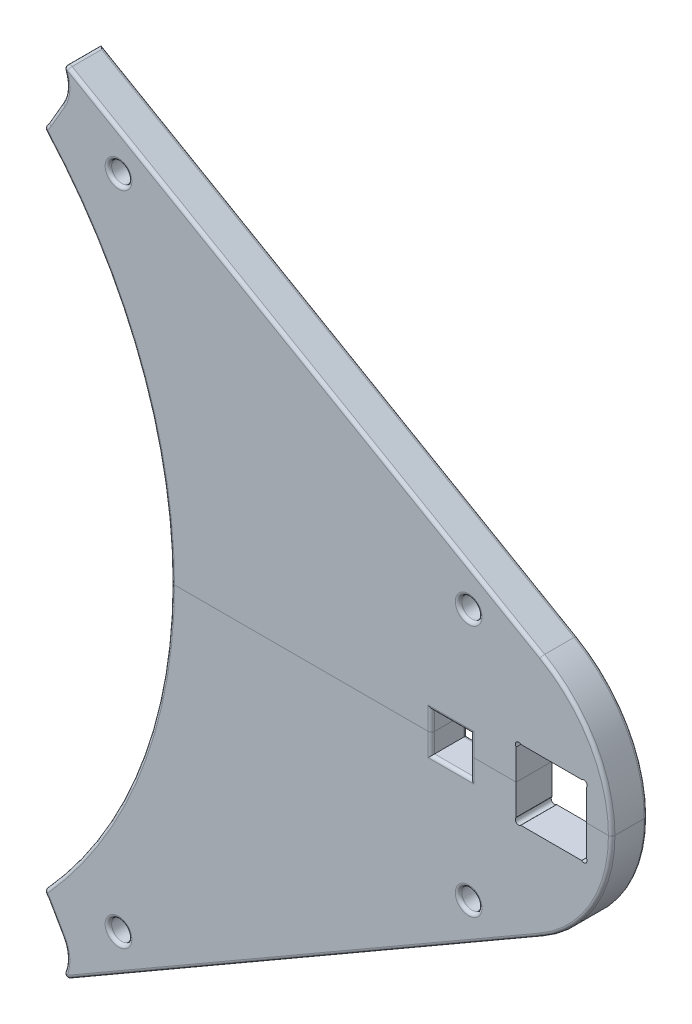
from build123d import *

# Parameters (mm, degrees)
BOSS_EXTRUDE1_DEPTH = 11
CUT_EXTRUDE1_DEPTH  = 9
SKETCH4_W           = 42.9
SKETCH4_H           = 3
BOSS_EXTRUDE2_DEPTH = 6
BOSS_EXTRUDE3_START = 2
BOSS_EXTRUDE3_DEPTH = 2
BOSS_EXTRUDE5_DEPTH = 4
SKETCH9_R           = 1.6
CUT_EXTRUDE3_DEPTH  = 195.492671892
SKETCH12_R          = 1.6
CUT_EXTRUDE6_DEPTH  = 199.866548237
SKETCH13_R          = 3.1
CUT_EXTRUDE7_DEPTH  = 9
FILLET1_R           = 1
FILLET2_R           = 1
SKETCH10_R          = 2.9
CUT_EXTRUDE4_DEPTH  = 2
CUT_EXTRUDE5_DEPTH  = 2


with BuildPart() as part:
    # Sketch2 → Boss-Extrude1 (new body)
    with BuildSketch(Plane.XY):
        with BuildLine():
            Line((-3, 37.320508076), (-151.33994183, 122.964613423))
            ThreePointArc((-151.33994183, 122.964613423), (-148.672488109, 117.025214433), (-150.019309217, 110.655140444))
            Line((-150.019309217, 110.655140444), (-154.249735612, 103.327826991))
            ThreePointArc((-154.249735612, 103.327826991), (-154.570890543, 102.807207058), (-154.921817791, 102.306172457))
            ThreePointArc((-154.921817791, 102.306172457), (-155.321726923, 101.80219857), (-155.751750724, 101.323662758))
            ThreePointArc((-155.751750724, 101.323662758), (-126.680553576, 54.324274768), (-116.534118443, 0))
            Line((-116.534118443, 0), (-36.75, 0))
            Line((-36.75, 0), (-36.75, 6))
            Line((-36.75, 6), (-24.75, 6))
            Line((-24.75, 6), (-24.75, 0))
            Line((-24.75, 0), (-10.75, 0))
            Line((-10.75, 0), (-10.75, 9.338562172))
            ThreePointArc((-10.75, 9.338562172), (-10.707106781, 10.707106781), (-9.338562172, 10.75))
            Line((-9.338562172, 10.75), (9.338562172, 10.75))
            ThreePointArc((9.338562172, 10.75), (10.707106781, 10.707106781), (10.75, 9.338562172))
            Line((10.75, 9.338562172), (10.75, 0))
            Line((10.75, 0), (18.547005384, 0))
            ThreePointArc((18.547005384, 0), (12.773502692, 21.547005384), (-3, 37.320508076))
        make_face()
    extrude(amount=BOSS_EXTRUDE1_DEPTH)

    # Sketch3 → Cut-Extrude1 (cut)
    with BuildSketch(Plane(origin=(0, 0, 0), x_dir=(-1, 0, 0), z_dir=(0, 0, -1))):
        with BuildLine():
            Line((45, 3), (39.75, 3))
            Line((39.75, 3), (39.75, 9))
            Line((39.75, 9), (21.75, 9))
            Line((21.75, 9), (21.75, 3))
            Line((21.75, 3), (16.530219865, 3))
            ThreePointArc((16.530219865, 3), (15.482056552, 7.129264091), (13.610574403, 10.956406998))
            ThreePointArc((13.610574403, 10.956406998), (13.129517789, 12.079935594), (13.010176178, 13.296278288))
            ThreePointArc((13.010176178, 13.296278288), (13.596801197, 15.169575131), (15.004001401, 16.538208595))
            Line((15.004001401, 16.538208595), (17.45348662, 17.952419546))
            Line((17.45348662, 17.952419546), (37.5, 29.526279442))
            ThreePointArc((37.5, 29.526279442), (42.5, 29.526279442), (45, 25.196152423))
            Line((45, 25.196152423), (45, 3))
        make_face()
        with BuildLine():
            Line((49, 0), (91.9, 0))
            Line((91.9, 0), (91.9, 3))
            Line((91.9, 3), (113.563437204, 3))
            ThreePointArc((113.563437204, 3), (123.360068461, 54.03718499), (149.625004336, 98.880483032))
            Line((149.625004336, 98.880483032), (64.095498823, 49.5))
            Line((64.095498823, 49.5), (66.095498823, 46.035898385))
            Line((66.095498823, 46.035898385), (56.5, 40.495934556))
            ThreePointArc((56.5, 40.495934556), (51.009618943, 35.005553499), (49, 27.505553499))
            Line((49, 27.505553499), (49, 0))
        make_face()
    extrude(amount=-CUT_EXTRUDE1_DEPTH, mode=Mode.SUBTRACT)

    # Sketch4 → Boss-Extrude2 (add)
    with BuildSketch(Plane(origin=(0, 0, 9), x_dir=(-1, 0, 0), z_dir=(0, 0, -1))):
        with Locations((70.45, 1.5)):
            Rectangle(SKETCH4_W, SKETCH4_H)
    extrude(amount=BOSS_EXTRUDE2_DEPTH)

    # Sketch5 → Boss-Extrude3 (add)
    with BuildSketch(Plane(origin=(0, 0, 0), x_dir=(-1, 0, 0), z_dir=(0, 0, -1)).offset(BOSS_EXTRUDE3_START)):
        with BuildLine():
            Line((6.5, 31.258330249), (9.5, 26.062177826))
            Line((9.5, 26.062177826), (151.519309217, 108.057064233))
            Line((151.519309217, 108.057064233), (150.019309217, 110.655140444))
            ThreePointArc((150.019309217, 110.655140444), (149.356631456, 112.02293142), (148.898363428, 113.472063706))
            Line((148.898363428, 113.472063706), (6.5, 31.258330249))
        make_face()
    extrude(amount=-BOSS_EXTRUDE3_DEPTH)

    # Sketch8 → Boss-Extrude5 (add)
    with BuildSketch(Plane(origin=(0, 3, 0), x_dir=(1, 0, 0), z_dir=(0, 1, 0))):
        Polygon((-113.563437204, 0), (-115.804358566, 0), (-115.804358566, -9), (-91.9, -9), (-91.9, 0), align=None)
    extrude(amount=BOSS_EXTRUDE5_DEPTH)

    # Sketch9 → Cut-Extrude3 (cut, through all)
    with BuildSketch(Plane(origin=(0, 7, 0), x_dir=(1, 0, 0), z_dir=(0, 1, 0))):
        with Locations(Location((-96.9, -4.5, 0), (0, 0, 180))):
            Circle(SKETCH9_R)
        with Locations((-108.693810631, -4.5)):
            Circle(SKETCH9_R)
    extrude(amount=-CUT_EXTRUDE3_DEPTH, mode=Mode.SUBTRACT)

    # Sketch12 → Cut-Extrude6 (cut, through all)
    with BuildSketch(Plane(origin=(0, 0, -2), x_dir=(-1, 0, 0), z_dir=(0, 0, -1))):
        with Locations((25.320508076, 38.660254038)):
            Circle(SKETCH12_R)
        with Locations(Location((132.698801141, 100.655140444, 0), (0, 0, 180))):
            Circle(SKETCH12_R)
    extrude(amount=-CUT_EXTRUDE6_DEPTH, mode=Mode.SUBTRACT)

    # Sketch13 → Cut-Extrude7 (cut)
    with BuildSketch(Plane.XY.offset(11)):
        with Locations((-132.698801141, 100.655140444)):
            Circle(SKETCH13_R)
        with Locations((-25.320508076, 38.660254038)):
            Circle(SKETCH13_R)
    extrude(amount=-CUT_EXTRUDE7_DEPTH, mode=Mode.SUBTRACT)

    # Fillet1
    fillet1_edges = [part.edges().sort_by_distance(p)[0] for p in [
        (-36.75, 3, 0),
        (-30.75, 6, 0),
        (-24.75, 3, 0),
        (-155.751750724, 101.323662758, 5.5),
        (12.773502692, 21.547005384, 0),
        (-77.169970915, 80.142560749, 0),
        (-126.680553576, 54.324274768, 0),
        (-151.33994183, 122.964613423, 5.5),
        (-154.940773072, 102.280800459, 11),
        (-126.680553576, 54.324274768, 11),
        (-36.75, 3, 11),
        (-30.75, 6, 11),
        (-24.75, 3, 11),
        (12.773502692, 21.547005384, 11),
        (-77.169970915, 80.142560749, 11),
        (-148.672488109, 117.025214433, 11),
        (-152.134522414, 106.991483718, 11),
    ]]
    fillet(fillet1_edges, radius=FILLET1_R)

    # Fillet2
    fillet2_edges = [part.edges().sort_by_distance(p)[0] for p in [
        (-124.076718642, 55.905561816, 0),
        (-124.076718642, 55.905561816, 9),
        (-113.693810631, 7, 4.5),
        (-102.796905316, 7, 9),
        (-91.9, 7, 4.5),
        (-102.796905316, 7, 0),
        (-91.9, 3, 6),
        (-91.9, 5, 9),
        (-135.798801141, 100.655140444, 11),
        (-28.420508076, 38.660254038, 11),
        (-42.5, 29.526279442, 0),
        (-26.2520007, 23.032244018, 0),
        (-13.123100608, 14.042925352, 0),
        (-15.482056552, 7.129264091, 0),
        (-19.140109932, 3, 0),
        (-21.75, 6, 0),
        (-30.75, 9, 0),
        (-39.75, 6, 0),
        (-42.375, 3, 0),
        (-45, 14.098076211, 0),
        (-26.2520007, 23.032244018, 9),
        (-13.123100608, 14.042925352, 9),
        (-15.482056552, 7.129264091, 9),
        (-16.530219865, 3, 4.5),
        (-19.140109932, 3, 9),
        (-21.75, 3, 4.5),
        (-21.75, 6, 9),
        (-21.75, 9, 4.5),
        (-30.75, 9, 9),
        (-39.75, 9, 4.5),
        (-39.75, 6, 9),
        (-39.75, 3, 4.5),
        (-42.375, 3, 9),
        (-45, 3, 4.5),
        (-45, 14.098076211, 9),
        (-42.5, 29.526279442, 9),
        (-51.009618943, 35.005553499, 0),
        (-49, 13.75277675, 0),
        (-91.9, 3.5, 0),
        (-106.86025158, 74.190241516, 0),
        (-65.095498823, 47.767949192, 0),
        (-61.297749412, 43.265916471, 0),
        (-49, 15.25277675, 9),
        (-70.45, 3, 9),
        (-149.625004336, 98.880483032, 4.5),
        (-106.86025158, 74.190241516, 9),
        (-64.095498823, 49.5, 4.5),
        (-65.095498823, 47.767949192, 9),
        (-66.095498823, 46.035898385, 4.5),
        (-61.297749412, 43.265916471, 9),
        (-51.009618943, 35.005553499, 9),
        (-49, 1.5, 3),
        (-49, 3, 6),
        (-70.45, 3, 3),
        (-91.9, 1.5, 3),
    ]]
    fillet(fillet2_edges, radius=FILLET2_R)


with BuildPart() as body_2:
    # Mirror1: mirrored copy
    add(part.part.mirror(Plane.ZX))

    # Sketch11 → Cut-Extrude5 (cut)
    with BuildSketch(Plane.XZ.offset(7)):
        Polygon((-105.34517907, 4.5), (-107.01949485, 7.4), (-110.368126412, 7.4), (-112.042442192, 4.5), (-110.368126412, 1.6), (-107.01949485, 1.6), align=None)
        Polygon((-100.248631561, 4.5), (-98.574315781, 1.6), (-95.225684219, 1.6), (-93.551368439, 4.5), (-95.225684219, 7.4), (-98.574315781, 7.4), align=None)
    extrude(amount=-CUT_EXTRUDE5_DEPTH, mode=Mode.SUBTRACT)


with BuildPart() as part_1:
    add(part.part)

    # Sketch10 → Cut-Extrude4 (cut)
    with BuildSketch(Plane(origin=(0, 7, 0), x_dir=(1, 0, 0), z_dir=(0, 1, 0))):
        with Locations(Location((-108.693810631, -4.5, 0), (0, 0, 180))):
            Circle(SKETCH10_R)
        with Locations(Location((-96.9, -4.5, 0), (0, 0, 180))):
            Circle(SKETCH10_R)
    extrude(amount=-CUT_EXTRUDE4_DEPTH, mode=Mode.SUBTRACT)


solid = Compound([body_2.part, part_1.part])
